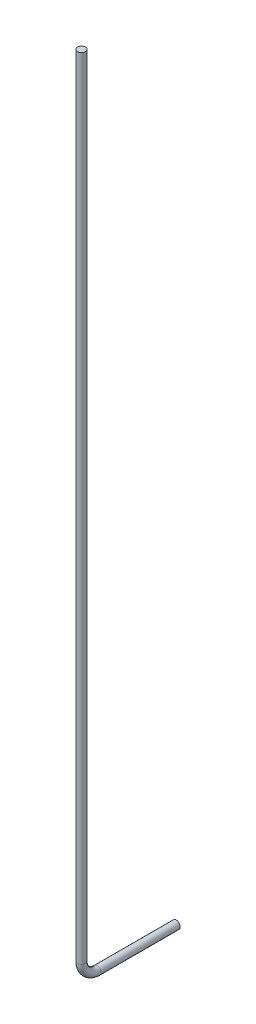
from build123d import *

# Parameters (mm, degrees)
SKETCH_1_R      = 1.27
EXTRUDE_1_DEPTH = 20
SKETCH_2_R      = 1.27


with BuildPart() as part:
    # ｽｹｯﾁ1 → ﾎﾞｽ - 押し出し1 (new body)
    with BuildSketch(Plane.XY):
        Circle(SKETCH_1_R)
    extrude(amount=EXTRUDE_1_DEPTH)

    # ｽｲｰﾌﾟ1: sweep along a path in ｽｹｯﾁ3
    with BuildLine(Plane(origin=(0, 0, 0), x_dir=(0, 0, -1), z_dir=(1, 0, 0))) as sweep_1_path:
        Line((-20, 0), (-25, 0))
        ThreePointArc((-25, 0), (-28.535533906, 1.464466094), (-30, 5))
        Line((-30, 5), (-30, 255))
    # ｽｹｯﾁ2 → ｽｲｰﾌﾟ1 (sweep)
    with BuildSketch(Plane.XY.offset(20)):
        Circle(SKETCH_2_R)
    sweep(path=sweep_1_path.line)


solid = part.part
